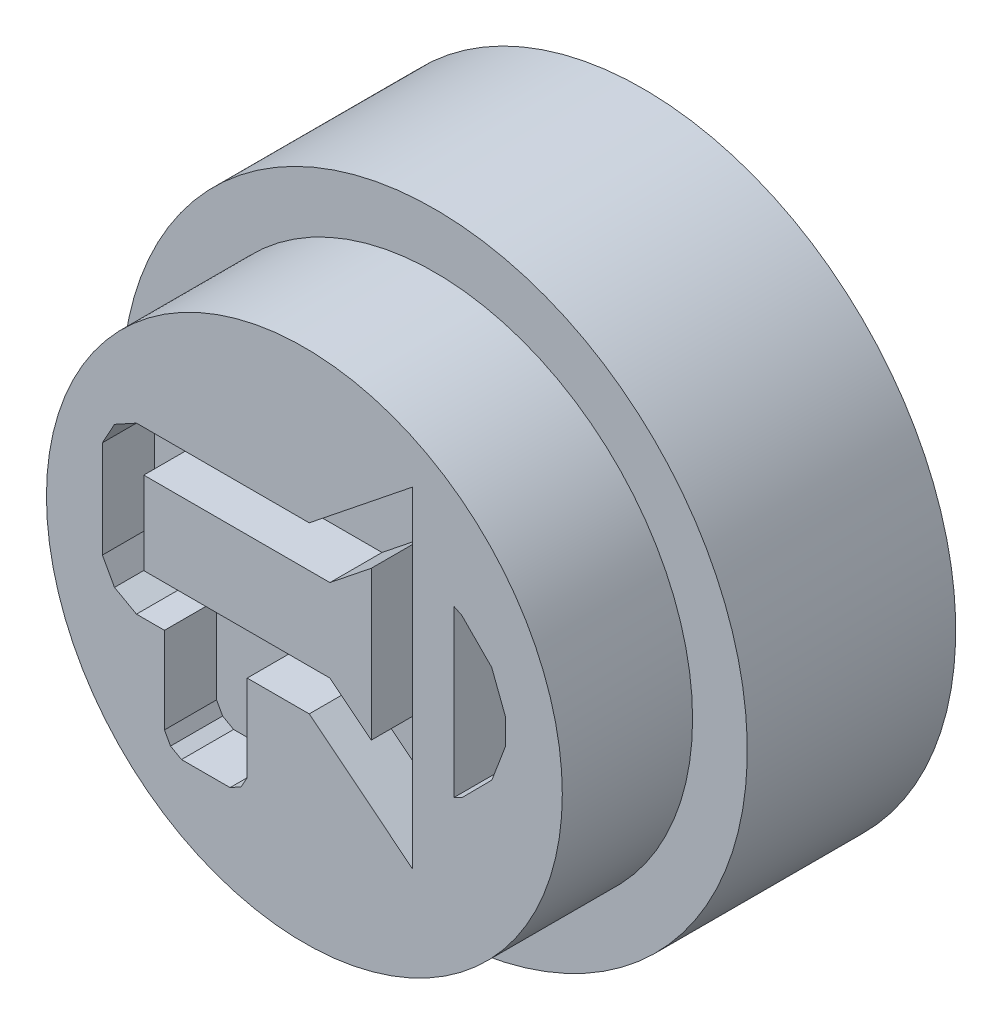
from build123d import *

# Parameters (mm, degrees)
ESQUISSE1_R             = 9.9
BOSS_EXTRU_1_DEPTH      = 15
ENL_V_MAT_EXTRU_1_DEPTH = 2
ESQUISSE6_R             = 9.9
ENL_V_MAT_EXTRU_2_DEPTH = 10
ESQUISSE8_R             = 12
BOSS_EXTRU_2_DEPTH      = 8


with BuildPart() as part:
    # Esquisse1 → Boss.-Extru.1 (new body)
    with BuildSketch(Plane.XY):
        Circle(ESQUISSE1_R)
    extrude(amount=BOSS_EXTRU_1_DEPTH)

    # Esquisse4 → Enlèv. mat.-Extru.1 (cut)
    # profile 1 of 2: a face of its own
    with BuildSketch(Plane.XY.offset(15)):
        Polygon((0.186527371, 4.159848226), (-6.163470089, 4.159848226), (-6.444587129, 4.159848226), (-7.287953489, 3.696780826), (-7.750975169, 2.853399226), (-7.750975169, 2.572297426), (-7.750975169, -0.602651774), (-7.750975169, -0.879638774), (-7.287953489, -1.723020374), (-6.444587129, -2.190179714), (-6.163470089, -2.190179714), (-5.369725169, -2.190179714), (-5.369725169, -5.365174634), (-5.369725169, -5.501610734), (-5.138214329, -5.923278674), (-4.716531149, -6.158927174), (-4.575972629, -6.158927174), (-2.988475169, -6.158927174), (-2.852039069, -6.158927174), (-2.430371129, -5.923278674), (-2.194722629, -5.501610734), (-2.194722629, -5.365174634), (-2.194722629, -2.190179714), (0.186527371, -2.190179714), (4.155251971, -5.365174634), (4.155251971, 7.334797426), align=None)
        Polygon((2.567777371, -1.871854214), (0.980302771, -0.602651774), (-6.163470089, -0.602651774), (-6.163470089, 2.572297426), (0.980302771, 2.572297426), (2.567777371, 3.841484626), align=None, mode=Mode.SUBTRACT)
    # profile 2 of 2: a face of its own
    with BuildSketch(Plane.XY.offset(15)):
        Polygon((7.727126971, 0.984822826), (7.727126971, 0.517640626), (7.193879371, -0.887944574), (6.048745771, -2.041345874), (5.742802771, -2.190179714), (5.742802771, 4.159848226), (6.044630971, 4.011029626), (7.189764571, 2.857514026), (7.727126971, 1.456119826), align=None)
    extrude(amount=-ENL_V_MAT_EXTRU_1_DEPTH, mode=Mode.SUBTRACT)

    # Esquisse6 → Enlèv. mat.-Extru.2 (cut)
    with BuildSketch(Plane(origin=(0, 0, 0), x_dir=(-1, 0, 0), z_dir=(0, 0, -1))):
        Circle(ESQUISSE6_R)
    extrude(amount=-ENL_V_MAT_EXTRU_2_DEPTH, mode=Mode.SUBTRACT)

    # Esquisse8 → Boss.-Extru.2 (add)
    with BuildSketch(Plane(origin=(0, 0, 10), x_dir=(-1, 0, 0), z_dir=(0, 0, -1))):
        Circle(ESQUISSE8_R)
    extrude(amount=BOSS_EXTRU_2_DEPTH)


solid = part.part
